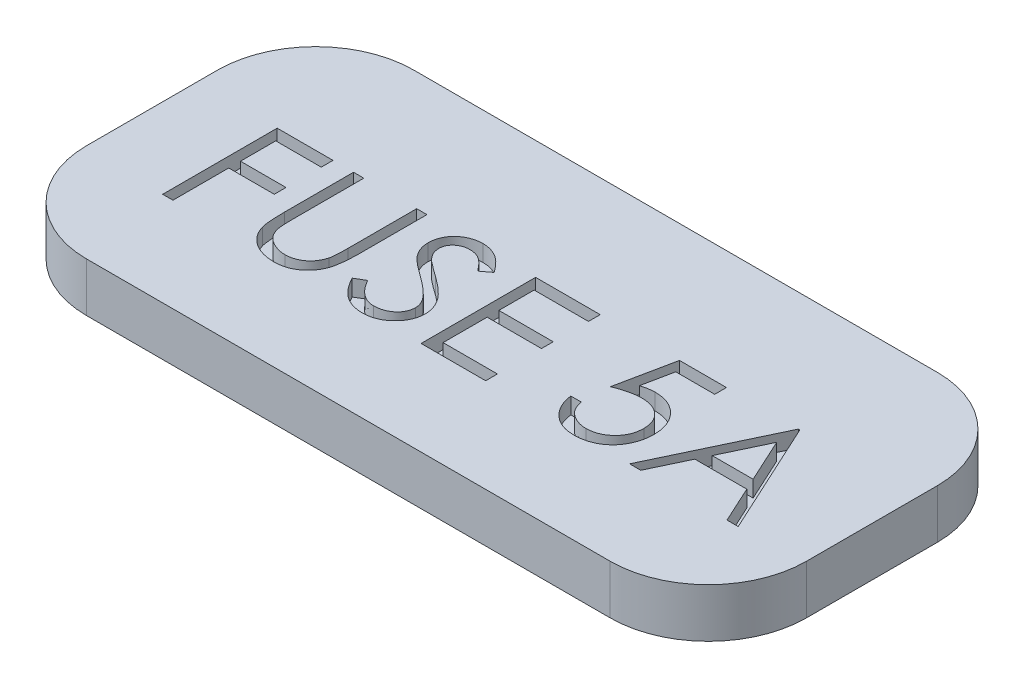
from build123d import *

# Parameters (mm, degrees)
SKETCH1_W           = 22
SKETCH1_H           = 10
BOSS_EXTRUDE1_DEPTH = 1.5
FILLET1_R           = 3
CUT_EXTRUDE1_DEPTH  = 0.5


with BuildPart() as part:
    # Sketch1 → Boss-Extrude1 (new body)
    with BuildSketch(Plane(origin=(0, 0, 0), x_dir=(1, 0, 0), z_dir=(0, 1, 0))):
        with Locations((-11, -5)):
            Rectangle(SKETCH1_W, SKETCH1_H)
    extrude(amount=BOSS_EXTRUDE1_DEPTH)

    # Fillet1
    fillet1_edges = [part.edges().sort_by_distance(p)[0] for p in [
        (0, 0.75, 10),
        (-22, 0.75, 10),
        (-22, 0.75, 0),
        (0, 0.75, 0),
    ]]
    fillet(fillet1_edges, radius=FILLET1_R)

    # Sketch2 → Cut-Extrude1 (cut)
    # profile 1 of 6: a face of its own
    with BuildSketch(Plane(origin=(0, 1.5, 0), x_dir=(1, 0, 0), z_dir=(0, 1, 0))):
        Polygon((-19.551282051, -3.625), (-17.846153846, -3.625), (-17.846153846, -3.983974359), (-19.237179487, -3.983974359), (-19.237179487, -5.060897436), (-17.846153846, -5.060897436), (-17.846153846, -5.419871795), (-19.237179487, -5.419871795), (-19.237179487, -7.125), (-19.551282051, -7.125), align=None)
    # profile 2 of 6: a face of its own
    with BuildSketch(Plane(origin=(0, 1.5, 0), x_dir=(1, 0, 0), z_dir=(0, 1, 0))):
        with BuildLine():
            Line((-17.217948718, -3.625), (-16.903846154, -3.625))
            Line((-16.903846154, -3.625), (-16.903846154, -5.722055288))
            add(Edge.make_bspline(
                [(-16.903846154, -5.722055288), (-16.903892898, -5.751736024), (-16.903981603, -5.808060335), (-16.903389089, -5.888228636), (-16.90172972, -5.959501095), (-16.900683561, -6.022152442), (-16.898356227, -6.07589519), (-16.89645818, -6.1210205), (-16.894017624, -6.157314703), (-16.891084506, -6.178495629), (-16.889823718, -6.18760016)],
                knots=[0, 0, 0, 0, 1.528628734, 2.90083645, 4.128790002, 5.200304208, 6.127813768, 6.898992206, 7.526736466, 8, 8, 8, 8], degree=3))
            add(Edge.make_bspline(
                [(-16.889823718, -6.18760016), (-16.884646259, -6.220446924), (-16.874583073, -6.284289653), (-16.848936695, -6.375197935), (-16.813119194, -6.457129393), (-16.770676151, -6.532640684), (-16.71474354, -6.599630044), (-16.647740005, -6.661341697), (-16.566562236, -6.715313501), (-16.47630163, -6.764664313), (-16.379016393, -6.804329396), (-16.279605127, -6.83432276), (-16.179562147, -6.85260166), (-16.112585982, -6.854718199), (-16.079326923, -6.855769231)],
                knots=[0, 0, 0, 0, 1.035780045, 2.013197591, 2.933192213, 3.817615948, 4.702609284, 5.640816605, 6.646850145, 7.73207398, 8.84249596, 9.914020372, 10.964143139, 12, 12, 12, 12], degree=3))
            add(Edge.make_bspline(
                [(-16.079326923, -6.855769231), (-16.050773183, -6.85469538), (-15.993830621, -6.852553882), (-15.90922419, -6.839292451), (-15.826824081, -6.815391885), (-15.746223402, -6.784552127), (-15.670672417, -6.743804536), (-15.600128975, -6.696733697), (-15.537165041, -6.64152282), (-15.479707043, -6.580422476), (-15.429672107, -6.511482676), (-15.386300966, -6.436204538), (-15.350775036, -6.353455191), (-15.333231511, -6.295300769), (-15.32421875, -6.265424679)],
                knots=[0, 0, 0, 0, 0.994687771, 1.983630487, 2.973142513, 3.978332533, 4.983357753, 5.956394766, 6.925816176, 7.893390482, 8.871859704, 9.88551698, 10.913711441, 12, 12, 12, 12], degree=3))
            add(Edge.make_bspline(
                [(-15.32421875, -6.265424679), (-15.321218625, -6.253076105), (-15.314533137, -6.225558505), (-15.308286092, -6.179037215), (-15.301779566, -6.124147851), (-15.297264996, -6.060496038), (-15.292863776, -5.988295065), (-15.290230703, -5.907168808), (-15.28901367, -5.817411847), (-15.28865099, -5.754774685), (-15.288461538, -5.722055288)],
                knots=[0, 0, 0, 0, 0.558680831, 1.244966039, 2.062412453, 2.990489873, 4.051219941, 5.244515665, 6.560634259, 8, 8, 8, 8], degree=3))
            Line((-15.288461538, -5.722055288), (-15.288461538, -3.625))
            Line((-15.288461538, -3.625), (-14.974358974, -3.625))
            Line((-14.974358974, -3.625), (-14.974358974, -5.738882212))
            add(Edge.make_bspline(
                [(-14.974358974, -5.738882212), (-14.974613095, -5.77698059), (-14.975109026, -5.851331893), (-14.979409603, -5.960283252), (-14.986266602, -6.063636234), (-14.99595469, -6.16140473), (-15.008791694, -6.253238889), (-15.023066914, -6.339943658), (-15.041246447, -6.42089665), (-15.062479848, -6.496729068), (-15.086753396, -6.568914581), (-15.118194545, -6.637423196), (-15.153619045, -6.704337596), (-15.195633698, -6.768645705), (-15.24284508, -6.830632258), (-15.296296761, -6.889921333), (-15.354220922, -6.947460379), (-15.417580481, -7.001773445), (-15.485331007, -7.051582122), (-15.557270964, -7.095379893), (-15.632847734, -7.132403511), (-15.71186486, -7.162879435), (-15.794356063, -7.185794034), (-15.880323423, -7.20286919), (-15.969962616, -7.212571487), (-16.030927272, -7.214013418), (-16.061798878, -7.21474359)],
                knots=[0, 0, 0, 0, 1.316592851, 2.569410997, 3.76748051, 4.895814652, 5.963796859, 6.97159953, 7.931736103, 8.829262218, 9.692595152, 10.560224239, 11.431080259, 12.30701507, 13.211635791, 14.121146779, 15.063487852, 16.031507147, 17.00238618, 17.966455255, 18.938106653, 19.907068911, 20.888905087, 21.893141452, 22.933117798, 24, 24, 24, 24], degree=3))
            add(Edge.make_bspline(
                [(-16.061798878, -7.21474359), (-16.095467981, -7.213958824), (-16.16152664, -7.212419118), (-16.258864707, -7.203596368), (-16.352178903, -7.186977973), (-16.44245478, -7.16581803), (-16.528463277, -7.136634292), (-16.611356722, -7.102536168), (-16.689715403, -7.060658907), (-16.764810532, -7.014065514), (-16.834635288, -6.961640876), (-16.898732691, -6.904500702), (-16.957208561, -6.843560325), (-17.009077258, -6.778159959), (-17.055198142, -6.708808252), (-17.094928356, -6.635309012), (-17.1290416, -6.557690696), (-17.146648167, -6.503737496), (-17.155548878, -6.47646234)],
                knots=[0, 0, 0, 0, 1.13879206, 2.234305948, 3.301075583, 4.341971843, 5.366689343, 6.369221514, 7.369726634, 8.367512178, 9.355451585, 10.318319045, 11.268648973, 12.207971039, 13.137398894, 14.081662264, 15.030215811, 16, 16, 16, 16], degree=3))
            add(Edge.make_bspline(
                [(-17.155548878, -6.47646234), (-17.160726036, -6.457829765), (-17.171955408, -6.417415296), (-17.183980705, -6.350528808), (-17.194089787, -6.27351389), (-17.203595345, -6.186365272), (-17.209204303, -6.089015405), (-17.214121742, -5.981506489), (-17.217983361, -5.863708528), (-17.217960588, -5.781654012), (-17.217948718, -5.738882212)],
                knots=[0, 0, 0, 0, 0.625038921, 1.35572334, 2.194682327, 3.136881307, 4.189498639, 5.346923369, 6.617055217, 8, 8, 8, 8], degree=3))
            Line((-17.217948718, -5.738882212), (-17.217948718, -3.625))
        make_face()
    # profile 3 of 6: a face of its own
    with BuildSketch(Plane(origin=(0, 1.5, 0), x_dir=(1, 0, 0), z_dir=(0, 1, 0))):
        with BuildLine():
            Line((-14.435897436, -6.449819712), (-14.140024038, -6.272435897))
            add(Edge.make_bspline(
                [(-14.140024038, -6.272435897), (-14.112505801, -6.318500282), (-14.059781921, -6.406757866), (-13.971830561, -6.526015907), (-13.88069765, -6.627378063), (-13.785708317, -6.710254671), (-13.687442369, -6.775503558), (-13.585258315, -6.821705789), (-13.479500504, -6.850521765), (-13.407526683, -6.854021851), (-13.371594551, -6.855769231)],
                knots=[0, 0, 0, 0, 1.272034388, 2.437168799, 3.508375237, 4.49857839, 5.41946034, 6.295179144, 7.148887113, 8, 8, 8, 8], degree=3))
            add(Edge.make_bspline(
                [(-13.371594551, -6.855769231), (-13.340907691, -6.854914558), (-13.280070918, -6.853220168), (-13.190508675, -6.836939366), (-13.103526872, -6.811927237), (-13.020918235, -6.776106306), (-12.94382262, -6.73276782), (-12.876215925, -6.680421642), (-12.817769812, -6.621815437), (-12.769960697, -6.556432782), (-12.733280662, -6.486115633), (-12.705088593, -6.413939682), (-12.68944352, -6.338771114), (-12.687086766, -6.288160651), (-12.685897436, -6.262620192)],
                knots=[0, 0, 0, 0, 1.095163259, 2.171163733, 3.241058638, 4.321873601, 5.38011039, 6.391990106, 7.366004449, 8.327778327, 9.272591725, 10.192022065, 11.087607919, 12, 12, 12, 12], degree=3))
            add(Edge.make_bspline(
                [(-12.685897436, -6.262620192), (-12.687371747, -6.233479343), (-12.690368805, -6.174240253), (-12.715700285, -6.0868406), (-12.755549532, -6.00034803), (-12.792312175, -5.946846765), (-12.811398237, -5.919070513)],
                knots=[0, 0, 0, 0, 0.938893495, 1.908633276, 2.914225137, 4, 4, 4, 4], degree=3))
            add(Edge.make_bspline(
                [(-12.811398237, -5.919070513), (-12.827068851, -5.899023689), (-12.859967346, -5.856937891), (-12.916524858, -5.794292655), (-12.982890973, -5.729674236), (-13.056794527, -5.660615179), (-13.140927616, -5.590327383), (-13.232655131, -5.515459105), (-13.33431899, -5.438857528), (-13.405618486, -5.387484962), (-13.442407853, -5.360977564)],
                knots=[0, 0, 0, 0, 0.722233717, 1.516239348, 2.393582979, 3.351407094, 4.387010283, 5.505090956, 6.712668013, 8, 8, 8, 8], degree=3))
            add(Edge.make_bspline(
                [(-13.442407853, -5.360977564), (-13.479231849, -5.334748976), (-13.549636525, -5.284601914), (-13.648095108, -5.21017763), (-13.736139571, -5.142133761), (-13.813378587, -5.079829749), (-13.879778184, -5.023257144), (-13.935861595, -4.972959205), (-13.980200152, -4.927575644), (-14.004855733, -4.898134302), (-14.015925481, -4.884915865)],
                knots=[0, 0, 0, 0, 1.452282411, 2.77665338, 3.964542531, 5.026858415, 5.96415736, 6.766646006, 7.446254459, 8, 8, 8, 8], degree=3))
            add(Edge.make_bspline(
                [(-14.015925481, -4.884915865), (-14.031398026, -4.864314829), (-14.061826863, -4.823800125), (-14.101992868, -4.760475267), (-14.136132031, -4.695652002), (-14.162894363, -4.629156137), (-14.185430582, -4.561921208), (-14.200588513, -4.493069962), (-14.21007991, -4.422911344), (-14.211051896, -4.375697843), (-14.211538462, -4.352063301)],
                knots=[0, 0, 0, 0, 1.068054152, 2.10047183, 3.106115577, 4.101338837, 5.06977816, 6.043150881, 7.020423561, 8, 8, 8, 8], degree=3))
            add(Edge.make_bspline(
                [(-14.211538462, -4.352063301), (-14.210233253, -4.315033527), (-14.207650732, -4.241765463), (-14.185810215, -4.134734633), (-14.151337322, -4.032548215), (-14.103042434, -3.936217882), (-14.040785081, -3.848251901), (-13.968739106, -3.767638414), (-13.88292762, -3.699869832), (-13.788774997, -3.640657773), (-13.685718625, -3.594311848), (-13.577727721, -3.559350868), (-13.464630649, -3.53954161), (-13.388027515, -3.536698845), (-13.349158654, -3.53525641)],
                knots=[0, 0, 0, 0, 1.005424448, 1.989358655, 2.955360095, 3.929531133, 4.905563448, 5.876582895, 6.856512386, 7.866279853, 8.892233794, 9.918561126, 10.94386622, 12, 12, 12, 12], degree=3))
            add(Edge.make_bspline(
                [(-13.349158654, -3.53525641), (-13.307914554, -3.536678962), (-13.225893202, -3.539507963), (-13.105243986, -3.564105494), (-12.98908327, -3.604806166), (-12.895640005, -3.650994824), (-12.822507244, -3.69712624), (-12.766734511, -3.739146064), (-12.71021706, -3.787521173), (-12.652499005, -3.842380419), (-12.594558346, -3.90422717), (-12.535534894, -3.972637859), (-12.475290625, -4.047194415), (-12.436534765, -4.100418915), (-12.416666667, -4.127704327)],
                knots=[0, 0, 0, 0, 1.286793592, 2.559021753, 3.825965368, 5.121522368, 5.803751409, 6.523245864, 7.299691795, 8.125521123, 9.008227632, 9.944561021, 10.946284179, 12, 12, 12, 12], degree=3))
            Line((-12.416666667, -4.127704327), (-12.700620994, -4.342948718))
            add(Edge.make_bspline(
                [(-12.700620994, -4.342948718), (-12.717766926, -4.320860028), (-12.750785983, -4.278322374), (-12.80091547, -4.218751059), (-12.848164118, -4.164334579), (-12.894714518, -4.117069451), (-12.938108149, -4.074367318), (-12.980225191, -4.037807561), (-13.020459543, -4.007031966), (-13.071176453, -3.974188406), (-13.134894172, -3.941631902), (-13.214878708, -3.914082824), (-13.298464983, -3.897527762), (-13.355394614, -3.895338874), (-13.384214744, -3.894230769)],
                knots=[0, 0, 0, 0, 1.181633172, 2.275549214, 3.290209073, 4.226197932, 5.078386478, 5.862611352, 6.581680152, 7.217281963, 8.414376989, 9.595101626, 10.782541182, 12, 12, 12, 12], degree=3))
            add(Edge.make_bspline(
                [(-13.384214744, -3.894230769), (-13.420371266, -3.895442469), (-13.490095713, -3.897779118), (-13.58908595, -3.923299104), (-13.678179875, -3.963480964), (-13.75473244, -4.019795942), (-13.818469417, -4.086516935), (-13.864574875, -4.16329579), (-13.89232504, -4.248078192), (-13.89571132, -4.307219849), (-13.897435897, -4.337339744)],
                knots=[0, 0, 0, 0, 1.14458467, 2.207223713, 3.21896685, 4.227309161, 5.202851033, 6.127160689, 7.046193047, 8, 8, 8, 8], degree=3))
            add(Edge.make_bspline(
                [(-13.897435897, -4.337339744), (-13.897042771, -4.356091222), (-13.896255875, -4.393624842), (-13.885281077, -4.449076264), (-13.871181748, -4.504387603), (-13.848839116, -4.559310186), (-13.817993813, -4.614804545), (-13.777488637, -4.671826282), (-13.726475325, -4.730877991), (-13.687398312, -4.769285365), (-13.666766827, -4.789563301)],
                knots=[0, 0, 0, 0, 0.858281714, 1.717966888, 2.583508476, 3.4729293, 4.427298488, 5.488583878, 6.674047936, 8, 8, 8, 8], degree=3))
            add(Edge.make_bspline(
                [(-13.666766827, -4.789563301), (-13.659105455, -4.796400327), (-13.640903787, -4.812643535), (-13.607627862, -4.839235816), (-13.563685063, -4.872038588), (-13.510222862, -4.912625905), (-13.446255501, -4.959707367), (-13.371775944, -5.012680979), (-13.287614412, -5.073266438), (-13.227892496, -5.115623979), (-13.196314103, -5.138020833)],
                knots=[0, 0, 0, 0, 0.420754252, 0.999615792, 1.744751191, 2.668019286, 3.750313428, 4.999500688, 6.413464383, 8, 8, 8, 8], degree=3))
            add(Edge.make_bspline(
                [(-13.196314103, -5.138020833), (-13.158328189, -5.165662193), (-13.084773733, -5.219185855), (-12.980116153, -5.299601535), (-12.885222345, -5.378249303), (-12.799759141, -5.45462691), (-12.722882233, -5.528155003), (-12.655444512, -5.599718184), (-12.596758832, -5.668803756), (-12.533579613, -5.757376332), (-12.469021794, -5.866157416), (-12.413580286, -5.999435655), (-12.378621939, -6.133231975), (-12.374050424, -6.223158812), (-12.371794872, -6.267528045)],
                knots=[0, 0, 0, 0, 1.163667725, 2.253281268, 3.268753668, 4.215851969, 5.092017293, 5.902905408, 6.650798638, 7.335211899, 8.59617414, 9.77448103, 10.901945474, 12, 12, 12, 12], degree=3))
            add(Edge.make_bspline(
                [(-12.371794872, -6.267528045), (-12.37245201, -6.29890641), (-12.373753525, -6.361053794), (-12.388714439, -6.45230887), (-12.410634104, -6.54093974), (-12.443671338, -6.625850853), (-12.483994496, -6.708595615), (-12.535160744, -6.787003516), (-12.594468429, -6.862809914), (-12.662502194, -6.933993406), (-12.736948096, -6.999339602), (-12.815631791, -7.057468663), (-12.898682064, -7.105936986), (-12.98564838, -7.145487828), (-13.076550717, -7.176421346), (-13.171358501, -7.198834215), (-13.270228012, -7.212589926), (-13.337428494, -7.214017687), (-13.371594551, -7.21474359)],
                knots=[0, 0, 0, 0, 0.983748083, 1.948392443, 2.894712957, 3.844097841, 4.80183111, 5.778335162, 6.776009319, 7.81870978, 8.863265674, 9.881300176, 10.883814829, 11.87499822, 12.874611388, 13.892143829, 14.928324115, 16, 16, 16, 16], degree=3))
            add(Edge.make_bspline(
                [(-13.371594551, -7.21474359), (-13.398029894, -7.214232408), (-13.450567654, -7.213216483), (-13.528277136, -7.204235202), (-13.604416725, -7.191528099), (-13.678031007, -7.171354029), (-13.750068419, -7.146877052), (-13.820215654, -7.116738719), (-13.888506707, -7.080621518), (-13.95532429, -7.039326493), (-14.020498465, -6.991268748), (-14.083417933, -6.935295252), (-14.146147118, -6.872949747), (-14.206834515, -6.802539184), (-14.266707659, -6.725201101), (-14.324586069, -6.640211917), (-14.381667786, -6.548034564), (-14.417483254, -6.483169478), (-14.435897436, -6.449819712)],
                knots=[0, 0, 0, 0, 0.915332311, 1.819136955, 2.706846663, 3.586547465, 4.459518054, 5.340707479, 6.227863349, 7.133153174, 8.059268498, 9.028702269, 10.047606654, 11.120612155, 12.245963614, 13.433783089, 14.680604001, 16, 16, 16, 16], degree=3))
        make_face()
    # profile 4 of 6: a face of its own
    with BuildSketch(Plane(origin=(0, 1.5, 0), x_dir=(1, 0, 0), z_dir=(0, 1, 0))):
        Polygon((-11.653846154, -3.625), (-9.679487179, -3.625), (-9.679487179, -3.983974359), (-11.33974359, -3.983974359), (-11.33974359, -5.060897436), (-9.679487179, -5.060897436), (-9.679487179, -5.419871795), (-11.33974359, -5.419871795), (-11.33974359, -6.766025641), (-9.679487179, -6.766025641), (-9.679487179, -7.125), (-11.653846154, -7.125), align=None)
    # profile 5 of 6: a face of its own
    with BuildSketch(Plane(origin=(0, 1.5, 0), x_dir=(1, 0, 0), z_dir=(0, 1, 0))):
        with BuildLine():
            Line((-5.820512821, -3.625), (-5.820512821, -3.983974359))
            Line((-5.820512821, -3.983974359), (-7.011017628, -3.983974359))
            Line((-7.011017628, -3.983974359), (-7.199619391, -4.904547276))
            add(Edge.make_bspline(
                [(-7.199619391, -4.904547276), (-7.162563517, -4.894317004), (-7.090773621, -4.87449747), (-6.98481376, -4.8524917), (-6.884221556, -4.839226256), (-6.818946186, -4.837414945), (-6.787359776, -4.836538462)],
                knots=[0, 0, 0, 0, 1.100273476, 2.13160584, 3.095893838, 4, 4, 4, 4], degree=3))
            add(Edge.make_bspline(
                [(-6.787359776, -4.836538462), (-6.748276036, -4.837384397), (-6.671427639, -4.839047718), (-6.558988692, -4.855019568), (-6.451655798, -4.880159482), (-6.349653428, -4.915280004), (-6.252792878, -4.960189737), (-6.161965316, -5.016289678), (-6.075807403, -5.081823009), (-5.995864809, -5.157168021), (-5.923340501, -5.240089637), (-5.859574511, -5.329247508), (-5.805411921, -5.423775171), (-5.761851166, -5.524575779), (-5.727066832, -5.630534933), (-5.703914837, -5.742767515), (-5.688498128, -5.860215635), (-5.686775742, -5.940520205), (-5.685897436, -5.981470353)],
                knots=[0, 0, 0, 0, 1.052922333, 2.070308379, 3.05430497, 4.020497103, 4.973039431, 5.925935799, 6.892292201, 7.88610001, 8.88166317, 9.857072816, 10.836096531, 11.812156883, 12.81219415, 13.836441305, 14.89672472, 16, 16, 16, 16], degree=3))
            add(Edge.make_bspline(
                [(-5.685897436, -5.981470353), (-5.686562511, -6.009992573), (-5.687883674, -6.06665156), (-5.694602261, -6.150795761), (-5.707537978, -6.233158594), (-5.724905702, -6.313750986), (-5.74744812, -6.392420358), (-5.774737173, -6.469391886), (-5.808133201, -6.544186493), (-5.844764576, -6.617511888), (-5.886011054, -6.687710395), (-5.931789562, -6.753359382), (-5.980155053, -6.815443663), (-6.032196438, -6.873297396), (-6.088397433, -6.926540414), (-6.1480774, -6.975488696), (-6.210760119, -7.020970026), (-6.277415362, -7.061138221), (-6.346557845, -7.098101177), (-6.419186062, -7.128424715), (-6.493646762, -7.155535243), (-6.571011638, -7.17714477), (-6.65110545, -7.194077325), (-6.734060226, -7.205577925), (-6.819440896, -7.213954363), (-6.877315908, -7.21447872), (-6.906550481, -7.21474359)],
                knots=[0, 0, 0, 0, 1.056347294, 2.098418968, 3.122841568, 4.141288669, 5.149314143, 6.15115421, 7.162517403, 8.180376062, 9.185164535, 10.17417709, 11.141909838, 12.097768115, 13.052685741, 14.0056014, 14.954263652, 15.917497458, 16.885230207, 17.854509472, 18.828990115, 19.81800267, 20.826176721, 21.857883937, 22.917946725, 24, 24, 24, 24], degree=3))
            add(Edge.make_bspline(
                [(-6.906550481, -7.21474359), (-6.941424661, -7.214052752), (-7.010035492, -7.21269361), (-7.110556059, -7.198475124), (-7.207270665, -7.178111208), (-7.299400766, -7.147474938), (-7.38777203, -7.109087643), (-7.471194748, -7.060571472), (-7.551800524, -7.005592368), (-7.62631256, -6.940712015), (-7.695468674, -6.869796333), (-7.757375183, -6.792838692), (-7.812508759, -6.71110925), (-7.859986506, -6.624211096), (-7.900484528, -6.532372565), (-7.932299516, -6.435249564), (-7.957977871, -6.33334956), (-7.968841291, -6.26319605), (-7.974358974, -6.227564103)],
                knots=[0, 0, 0, 0, 1.0467383, 2.05933395, 3.04377827, 4.011590433, 4.970194871, 5.932262533, 6.905835911, 7.896367577, 8.894135286, 9.877477877, 10.858688626, 11.851381753, 12.8477658, 13.868841284, 14.917554742, 16, 16, 16, 16], degree=3))
            Line((-7.974358974, -6.227564103), (-7.66025641, -6.227564103))
            add(Edge.make_bspline(
                [(-7.66025641, -6.227564103), (-7.652527853, -6.260940555), (-7.637673136, -6.32509195), (-7.605067388, -6.415223291), (-7.565201512, -6.495542515), (-7.517797164, -6.567112098), (-7.461247133, -6.629521095), (-7.396717704, -6.685138157), (-7.324369981, -6.735313287), (-7.243976752, -6.777136054), (-7.159163672, -6.812804807), (-7.070396462, -6.836556502), (-6.980092116, -6.853257395), (-6.919013746, -6.854929156), (-6.888321314, -6.855769231)],
                knots=[0, 0, 0, 0, 1.136247022, 2.183929868, 3.172523383, 4.106158343, 5.02341133, 5.958108904, 6.928429099, 7.938127109, 8.96079061, 9.975095812, 10.982467395, 12, 12, 12, 12], degree=3))
            add(Edge.make_bspline(
                [(-6.888321314, -6.855769231), (-6.85836287, -6.854948453), (-6.799374447, -6.853332334), (-6.712563061, -6.840893322), (-6.628750187, -6.821735751), (-6.54876283, -6.793065896), (-6.47120129, -6.758221178), (-6.39802752, -6.713506102), (-6.327124643, -6.662046083), (-6.260696509, -6.603089453), (-6.19985706, -6.538119759), (-6.146100939, -6.468642365), (-6.101324025, -6.394525519), (-6.063589916, -6.317052366), (-6.034936618, -6.235373809), (-6.014495636, -6.149872634), (-6.002492578, -6.060337653), (-6.000841398, -5.999268344), (-6, -5.968149038)],
                knots=[0, 0, 0, 0, 1.027316725, 2.022795036, 3.002884548, 3.971462791, 4.93288096, 5.914575861, 6.907176829, 7.935150275, 8.956128384, 9.956726525, 10.942570165, 11.921478529, 12.907843606, 13.90538589, 14.932640048, 16, 16, 16, 16], degree=3))
            add(Edge.make_bspline(
                [(-6, -5.968149038), (-6.000658479, -5.940073287), (-6.001947359, -5.885118998), (-6.01247793, -5.804719791), (-6.030794902, -5.728646749), (-6.056218782, -5.656532515), (-6.08849829, -5.588309073), (-6.127944602, -5.523906013), (-6.175298, -5.464172179), (-6.229389889, -5.409079626), (-6.288647929, -5.358234751), (-6.354091672, -5.314890664), (-6.424351599, -5.278426747), (-6.498581198, -5.246958748), (-6.578546097, -5.224358003), (-6.662662729, -5.207390118), (-6.751839437, -5.197574755), (-6.812810125, -5.196212866), (-6.844150641, -5.195512821)],
                knots=[0, 0, 0, 0, 1.045622112, 2.046656509, 3.013763289, 3.955457236, 4.890082067, 5.820317437, 6.762574623, 7.722996705, 8.69280354, 9.665887285, 10.63943826, 11.638615906, 12.663482002, 13.728887084, 14.832589034, 16, 16, 16, 16], degree=3))
            add(Edge.make_bspline(
                [(-6.844150641, -5.195512821), (-6.87127957, -5.196093412), (-6.927293925, -5.197292185), (-7.013216752, -5.206118682), (-7.103508475, -5.220357976), (-7.19782297, -5.239944224), (-7.296443479, -5.265575301), (-7.399161879, -5.296289801), (-7.506194146, -5.3330118), (-7.57831187, -5.360744014), (-7.615384615, -5.375)],
                knots=[0, 0, 0, 0, 0.817624296, 1.688186739, 2.600797293, 3.572016777, 4.590301741, 5.671205678, 6.80286297, 8, 8, 8, 8], degree=3))
            Line((-7.615384615, -5.375), (-7.256410256, -3.625))
            Line((-7.256410256, -3.625), (-5.820512821, -3.625))
        make_face()
    # profile 6 of 6: a face of its own
    with BuildSketch(Plane(origin=(0, 1.5, 0), x_dir=(1, 0, 0), z_dir=(0, 1, 0))):
        Polygon((-3.576923077, -3.625), (-1.961538462, -7.125), (-2.302984776, -7.125), (-2.82041266, -6.003205128), (-4.407051282, -6.003205128), (-4.939202724, -7.125), (-5.282051282, -7.125), (-3.621794872, -3.625), align=None)
        Polygon((-3.602864583, -4.307191506), (-4.236678686, -5.644230769), (-2.985877404, -5.644230769), align=None, mode=Mode.SUBTRACT)
    extrude(amount=-CUT_EXTRUDE1_DEPTH, mode=Mode.SUBTRACT)


solid = part.part
